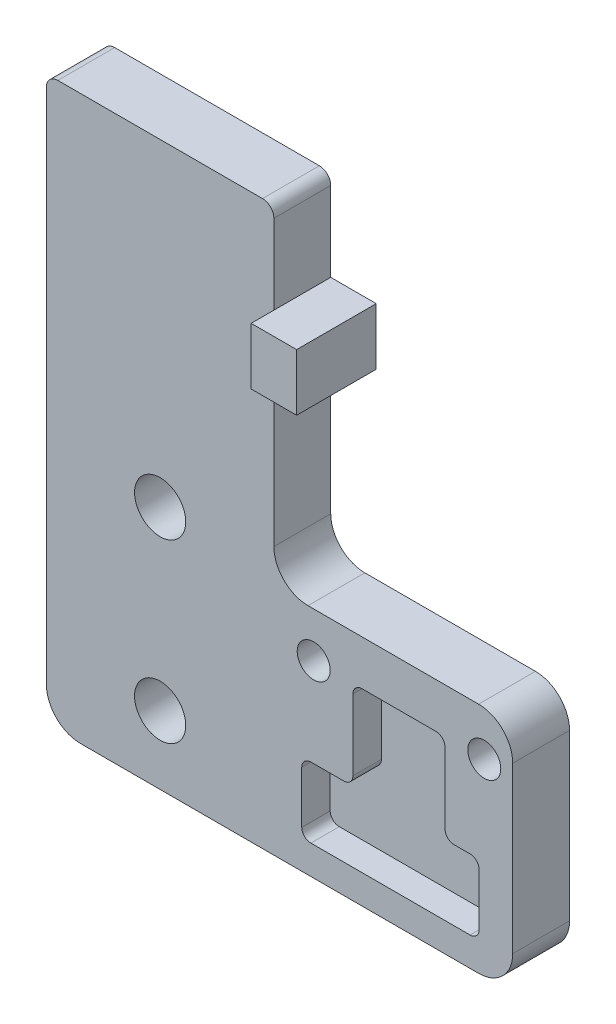
from build123d import *

# Parameters (mm, degrees)
SKETCH1_W                      = 41
SKETCH1_H                      = 49.5
BOSS_EXTRUDE1_DEPTH            = 5
SKETCH2_W                      = 21
SKETCH2_H                      = 29
CUT_EXTRUDE1_DEPTH             = 45.342417616
SKETCH3_W                      = 5
SKETCH3_H                      = 13
BOSS_EXTRUDE2_DEPTH            = 4
SKETCH4_W                      = 4
SKETCH4_H                      = 8
CUT_EXTRUDE2_DEPTH             = 45.342417616
SKETCH5_W                      = 4
SKETCH5_H                      = 5
BOSS_EXTRUDE3_DEPTH            = 2
CUT_EXTRUDE3_DEPTH             = 2.5
F_4_5_4_5_DIAMETER_HOLE1_D     = 4.5
F_4_5_4_5_DIAMETER_HOLE1_DEPTH = 7
F_2_9_2_9_DIAMETER_HOLE1_D     = 2.9
F_2_9_2_9_DIAMETER_HOLE1_DEPTH = 7
FILLET1_R                      = 0.8
FILLET2_R                      = 1
FILLET3_R                      = 3


with BuildPart() as part:
    # Sketch1 → Boss-Extrude1 (new body)
    with BuildSketch(Plane.XY.offset(5)):
        with Locations((0, 14.25)):
            Rectangle(SKETCH1_W, SKETCH1_H)
    extrude(amount=-BOSS_EXTRUDE1_DEPTH)

    # Sketch2 → Cut-Extrude1 (cut, through all)
    with BuildSketch(Plane.XY.offset(5)):
        with Locations((10, 24.5)):
            Rectangle(SKETCH2_W, SKETCH2_H)
    extrude(amount=-CUT_EXTRUDE1_DEPTH, mode=Mode.SUBTRACT)

    # Sketch3 → Boss-Extrude2 (add)
    with BuildSketch(Plane(origin=(-0.5, 0, 0), x_dir=(0, 0, -1), z_dir=(1, 0, 0))):
        with Locations((-2.5, 32.5)):
            Rectangle(SKETCH3_W, SKETCH3_H)
    extrude(amount=BOSS_EXTRUDE2_DEPTH)

    # Sketch4 → Cut-Extrude2 (cut, through all)
    with BuildSketch(Plane(origin=(0, 0, 0), x_dir=(-1, 0, 0), z_dir=(0, 0, -1))):
        with Locations((-1.5, 35)):
            Rectangle(SKETCH4_W, SKETCH4_H)
    extrude(amount=-CUT_EXTRUDE2_DEPTH, mode=Mode.SUBTRACT)

    # Sketch5 → Boss-Extrude3 (add)
    with BuildSketch(Plane.XY.offset(5)):
        with Locations((1.5, 28.5)):
            Rectangle(SKETCH5_W, SKETCH5_H)
    extrude(amount=BOSS_EXTRUDE3_DEPTH)

    # Sketch6 → Cut-Extrude3 (cut)
    with BuildSketch(Plane.XY.offset(5)):
        Polygon((17.55, -1.78), (14.55, -1.78), (14.55, 6.05), (6.45, 6.05), (6.45, -1.78), (1.95, -1.78), (1.95, -7.953122176), (17.55, -7.953122176), align=None)
    extrude(amount=-CUT_EXTRUDE3_DEPTH, mode=Mode.SUBTRACT)

    # Ø4.5 (4.5) Diameter Hole1
    with Locations(Plane(origin=(0, 0, 0), x_dir=(-1, 0, 0), z_dir=(0, 0, -1))):
        with Locations((10.5, 11), (10.5, -4.5)):
            Hole(F_4_5_4_5_DIAMETER_HOLE1_D / 2, depth=F_4_5_4_5_DIAMETER_HOLE1_DEPTH)

    # Ø2.9 (2.9) Diameter Hole1
    with Locations(Plane(origin=(0, 0, 0), x_dir=(-1, 0, 0), z_dir=(0, 0, -1))):
        with Locations((-3, 6.05), (-18, 6.05)):
            Hole(F_2_9_2_9_DIAMETER_HOLE1_D / 2, depth=F_2_9_2_9_DIAMETER_HOLE1_DEPTH)

    # Fillet1
    fillet1_edges = [part.edges().sort_by_distance(p)[0] for p in [
        (17.55, -1.78, 3.75),
        (17.55, -7.953122176, 3.75),
        (1.95, -7.953122176, 3.75),
        (1.95, -1.78, 3.75),
        (6.45, -1.78, 3.75),
        (6.45, 6.05, 3.75),
        (14.55, 6.05, 3.75),
        (14.55, -1.78, 3.75),
    ]]
    fillet(fillet1_edges, radius=FILLET1_R)

    # Fillet2
    fillet2_edges = [part.edges().sort_by_distance(p)[0] for p in [
        (-0.5, 39, 2.5),
        (-20.5, 39, 2.5),
    ]]
    fillet(fillet2_edges, radius=FILLET2_R)

    # Fillet3
    fillet3_edges = [part.edges().sort_by_distance(p)[0] for p in [
        (20.5, 10, 2.5),
        (-0.5, 10, 2.5),
        (-20.5, -10.5, 2.5),
        (20.5, -10.5, 2.5),
    ]]
    fillet(fillet3_edges, radius=FILLET3_R)


solid = part.part
